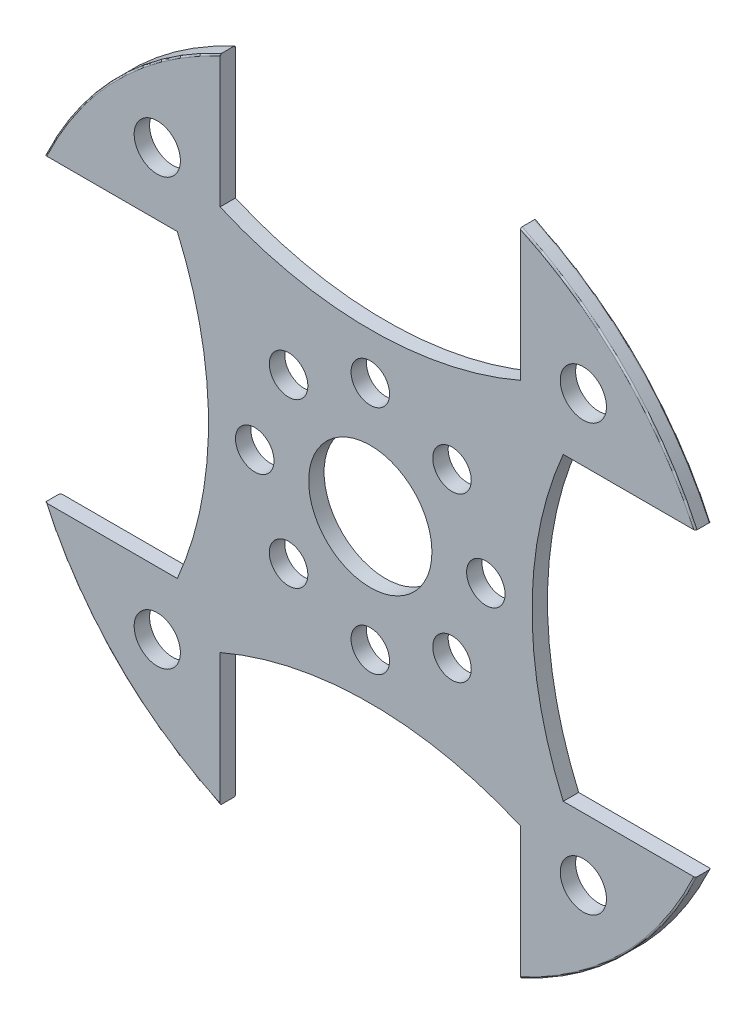
from build123d import *

# Parameters (mm, degrees)
SKETCH_1_R      = 4
SKETCH_1_R_2    = 1.25
SKETCH_1_R_3    = 1.5
EXTRUDE_1_DEPTH = 1
FILLET_1_R      = 0.1


with BuildPart() as part:
    # Эскиз1 → Бобышка-Вытянуть1 (new body)
    with BuildSketch(Plane.XY):
        with BuildLine():
            Line((21.106870919, 9.75), (12.523623513, 9.75))
            ThreePointArc((12.523623513, 9.75), (10.5, 0), (12.523623513, -9.75))
            Line((12.523623513, -9.75), (21.106870919, -9.75))
            ThreePointArc((21.106870919, -9.75), (16.440232663, -16.440232663), (9.75, -21.106870919))
            Line((9.75, -21.106870919), (9.75, -12.523623513))
            ThreePointArc((9.75, -12.523623513), (0, -10.5), (-9.75, -12.523623513))
            Line((-9.75, -12.523623513), (-9.75, -21.106870919))
            ThreePointArc((-9.75, -21.106870919), (-16.440232663, -16.440232663), (-21.106870919, -9.75))
            Line((-21.106870919, -9.75), (-12.523623513, -9.75))
            ThreePointArc((-12.523623513, -9.75), (-10.5, 0), (-12.523623513, 9.75))
            Line((-12.523623513, 9.75), (-21.106870919, 9.75))
            ThreePointArc((-21.106870919, 9.75), (-16.440232663, 16.440232663), (-9.75, 21.106870919))
            Line((-9.75, 21.106870919), (-9.75, 12.523623513))
            ThreePointArc((-9.75, 12.523623513), (0, 10.5), (9.75, 12.523623513))
            Line((9.75, 12.523623513), (9.75, 21.106870919))
            ThreePointArc((9.75, 21.106870919), (16.440232663, 16.440232663), (21.106870919, 9.75))
        make_face()
        Circle(SKETCH_1_R, mode=Mode.SUBTRACT)
        with Locations((0, 7.5)):
            Circle(SKETCH_1_R_2, mode=Mode.SUBTRACT)
        with Locations((5.303300859, 5.303300859)):
            Circle(SKETCH_1_R_2, mode=Mode.SUBTRACT)
        with Locations((7.5, 0)):
            Circle(SKETCH_1_R_2, mode=Mode.SUBTRACT)
        with Locations((5.303300859, -5.303300859)):
            Circle(SKETCH_1_R_2, mode=Mode.SUBTRACT)
        with Locations((0, -7.5)):
            Circle(SKETCH_1_R_2, mode=Mode.SUBTRACT)
        with Locations((-5.303300859, -5.303300859)):
            Circle(SKETCH_1_R_2, mode=Mode.SUBTRACT)
        with Locations((-7.5, 0)):
            Circle(SKETCH_1_R_2, mode=Mode.SUBTRACT)
        with Locations((-5.303300859, 5.303300859)):
            Circle(SKETCH_1_R_2, mode=Mode.SUBTRACT)
        with Locations((13.825687912, 13.825687912)):
            Circle(SKETCH_1_R_3, mode=Mode.SUBTRACT)
        with Locations((13.825687912, -13.825687912)):
            Circle(SKETCH_1_R_3, mode=Mode.SUBTRACT)
        with Locations((-13.825687912, -13.825687912)):
            Circle(SKETCH_1_R_3, mode=Mode.SUBTRACT)
        with Locations((-13.825687912, 13.825687912)):
            Circle(SKETCH_1_R_3, mode=Mode.SUBTRACT)
    extrude(amount=EXTRUDE_1_DEPTH)

    # Скругление1
    fillet_1_edges = [part.edges().sort_by_distance(p)[0] for p in [
        (16.440232663, 16.440232663, 1),
        (16.440232663, -16.440232663, 0),
        (-16.440232663, -16.440232663, 0),
        (-16.440232663, 16.440232663, 0),
        (16.440232663, 16.440232663, 0),
        (-16.440232663, 16.440232663, 1),
        (-16.440232663, -16.440232663, 1),
        (16.440232663, -16.440232663, 1),
    ]]
    fillet(fillet_1_edges, radius=FILLET_1_R)


solid = part.part
